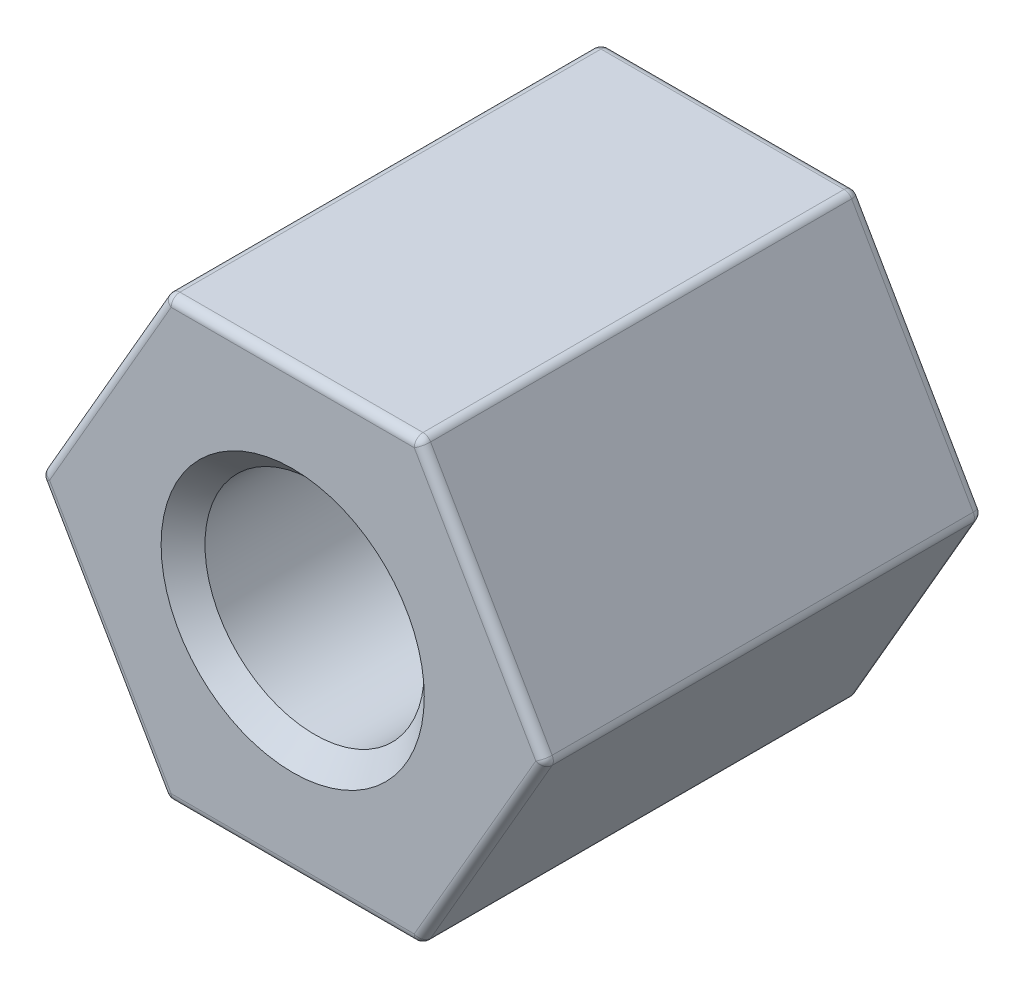
from build123d import *

# Parameters (mm, degrees)
EXTRUDE_1_DEPTH     = 5
SKETCH_2_R          = 1.25
CUT_EXTRUDE_1_DEPTH = 2.5
CUT_EXTRUDE_START   = -2.5
SKETCH_3_R          = 1.25
CUT_EXTRUDE_2_DEPTH = 2.5
CHAMFER_1_SIZE      = 0.25
FILLET_1_R          = 0.1


with BuildPart() as part:
    # Эскиз1 → Бобышка-Вытянуть1 (new body)
    with BuildSketch(Plane.XY):
        Polygon((2.886751346, 0), (1.443375673, 2.5), (-1.443375673, 2.5), (-2.886751346, 0), (-1.443375673, -2.5), (1.443375673, -2.5), align=None)
    extrude(amount=EXTRUDE_1_DEPTH)

    # Эскиз2 → Вырез-Вытянуть1 (cut)
    with BuildSketch(Plane.XY.offset(5)):
        Circle(SKETCH_2_R)
    extrude(amount=-CUT_EXTRUDE_1_DEPTH, mode=Mode.SUBTRACT)

    # Эскиз3 → Вырез-Вытянуть2 (cut)
    with BuildSketch(Plane(origin=(0, 0, 0), x_dir=(-1, 0, 0), z_dir=(0, 0, -1)).offset(CUT_EXTRUDE_START)):
        with Locations(Location((0, 0, 0), (0, 0, 180))):
            Circle(SKETCH_3_R)
    extrude(amount=CUT_EXTRUDE_2_DEPTH, mode=Mode.SUBTRACT)

    # Фаска1
    chamfer_1_edges = [part.edges().sort_by_distance(p)[0] for p in [
        (-1.25, 0, 5),
        (-1.25, 0, 0),
    ]]
    chamfer(chamfer_1_edges, length=CHAMFER_1_SIZE)

    # Скругление1
    fillet_1_edges = [part.edges().sort_by_distance(p)[0] for p in [
        (0, 2.5, 5),
        (1.443375673, -2.5, 2.5),
        (-1.443375673, -2.5, 2.5),
        (-2.886751346, 0, 2.5),
        (-1.443375673, 2.5, 2.5),
        (1.443375673, 2.5, 2.5),
        (2.886751346, 0, 2.5),
        (-2.165063509, 1.25, 5),
        (-2.165063509, -1.25, 5),
        (0, -2.5, 5),
        (2.165063509, -1.25, 5),
        (0, -2.5, 0),
        (-2.165063509, -1.25, 0),
        (-2.165063509, 1.25, 0),
        (2.165063509, 1.25, 5),
        (0, 2.5, 0),
        (2.165063509, 1.25, 0),
        (2.165063509, -1.25, 0),
    ]]
    fillet(fillet_1_edges, radius=FILLET_1_R)


solid = part.part
